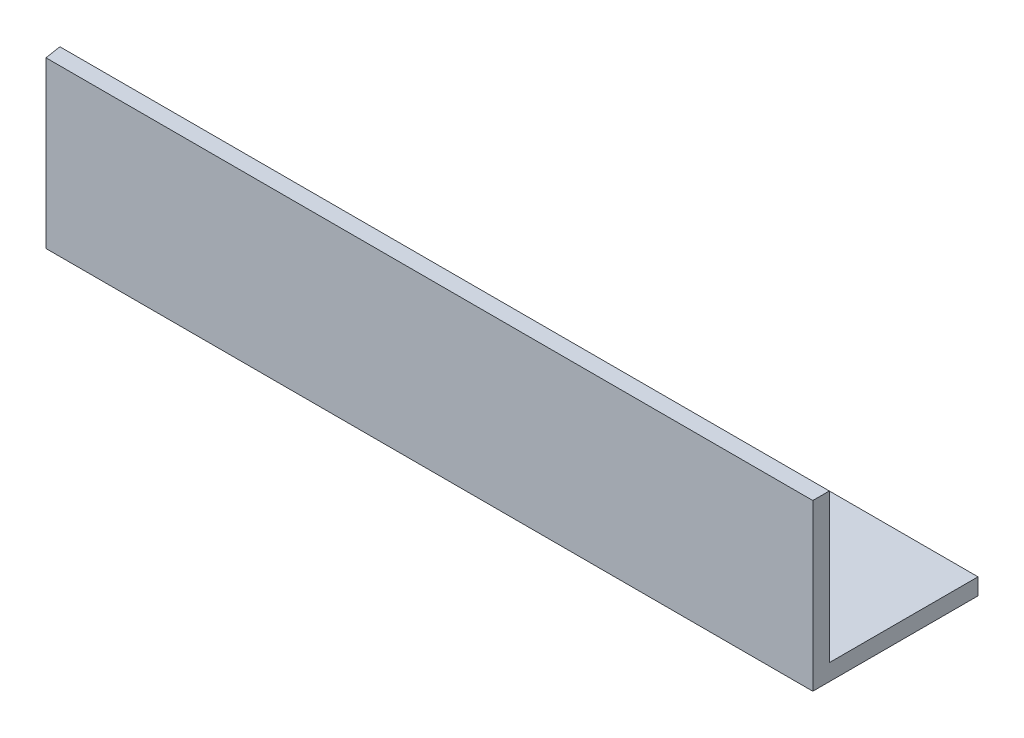
from build123d import *

# Parameters (mm, degrees)
BOSS_EXTRUDE1_DEPTH = 96
CUT_EXTRUDE1_DEPTH  = 101.079968026


with BuildPart() as part:
    # Sketch1 → Boss-Extrude1 (new body)
    with BuildSketch(Plane(origin=(0, 0, 0), x_dir=(0, 0, -1), z_dir=(1, 0, 0))):
        Polygon((0, 20), (0, 0), (20, 0), (20, 2), (2, 2), (2, 20), align=None)
    extrude(amount=BOSS_EXTRUDE1_DEPTH)

    # Sketch2 → Cut-Extrude1 (cut, through all)
    with BuildSketch(Plane(origin=(0, 0, 0), x_dir=(1, 0, 0), z_dir=(0, 1, 0))):
        Polygon((0, 20), (0, 0), (3.167688806, 0), align=None)
    extrude(amount=CUT_EXTRUDE1_DEPTH, mode=Mode.SUBTRACT)


solid = part.part
